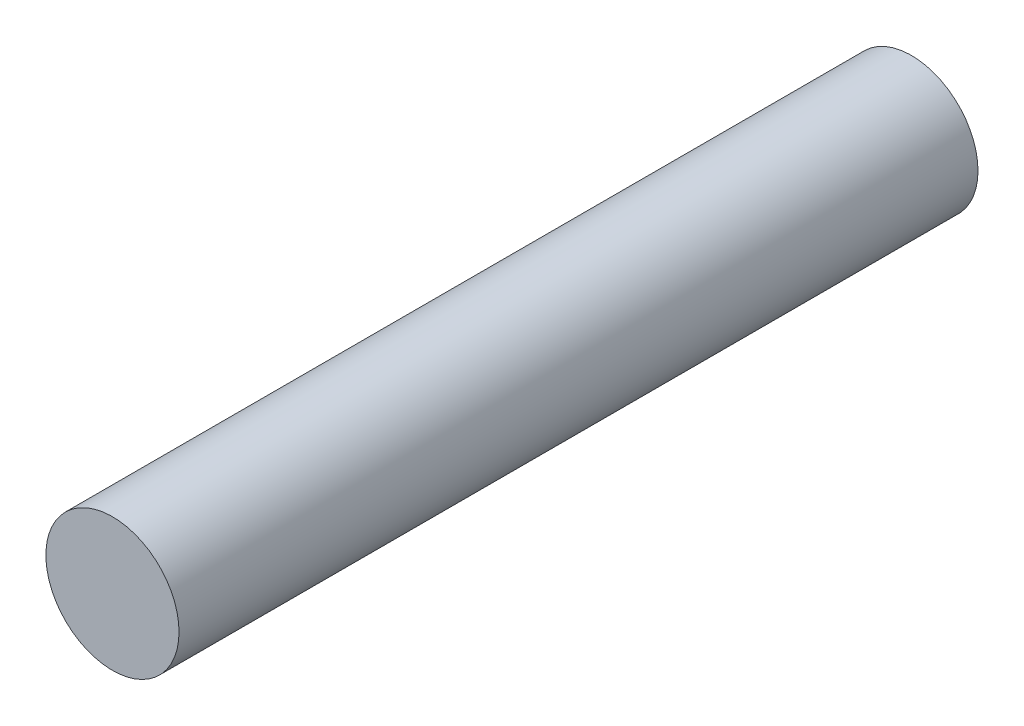
from build123d import *

# Parameters (mm, degrees)
SKETCH1_R           = 25
BOSS_EXTRUDE1_DEPTH = 300


with BuildPart() as part:
    # Sketch1 → Boss-Extrude1 (new body)
    with BuildSketch(Plane.XY):
        Circle(SKETCH1_R)
    extrude(amount=BOSS_EXTRUDE1_DEPTH)


solid = part.part
